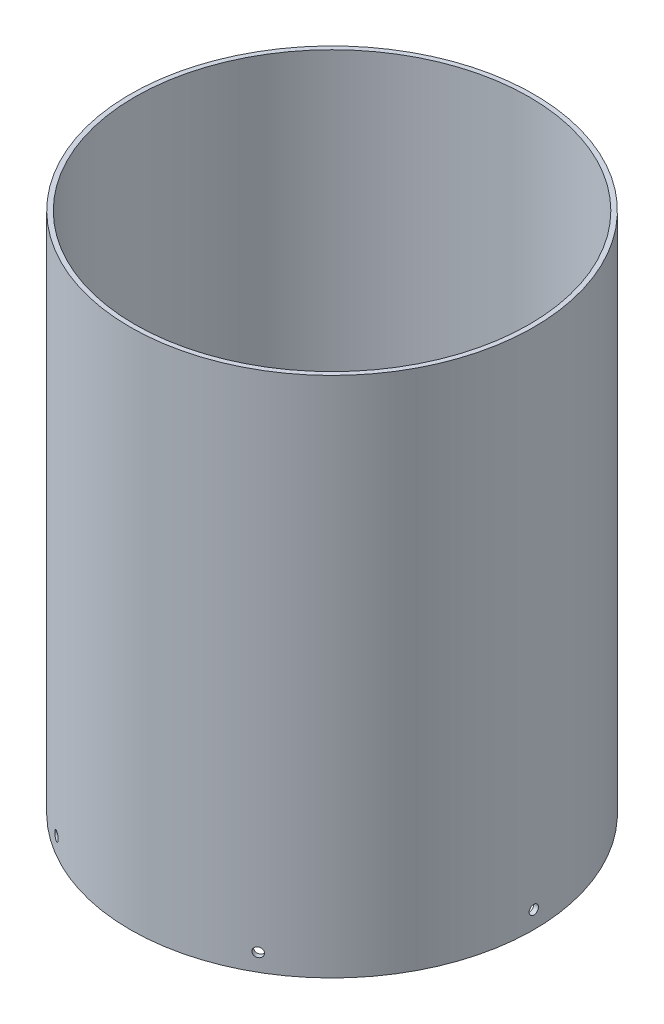
from build123d import *

# Parameters (mm, degrees)
SKETCH1_R               = 87
SKETCH1_R_2             = 85
BOSS_EXTRUDE1_DEPTH     = 225
CUT_EXTRUDE1_REACH      = 299.439
CUT_EXTRUDE1_END_RADIUS = 85
SKETCH2_R               = 2
CIRPATTERN1_COUNT       = 6


with BuildPart() as part:
    # Sketch1 → Boss-Extrude1 (new body)
    with BuildSketch(Plane(origin=(0, 0, 0), x_dir=(1, 0, 0), z_dir=(0, 1, 0))):
        with Locations(Location((0, 0, 0), (0, 0, 270))):
            Circle(SKETCH1_R)
        with Locations(Location((0, 0, 0), (0, 0, 270))):
            Circle(SKETCH1_R_2, mode=Mode.SUBTRACT)
    extrude(amount=BOSS_EXTRUDE1_DEPTH)

    # Cut-Extrude1: up to this cylinder (the profile starts outside it)
    cut_extrude1_end = Plane(origin=(0, 7.5, 0), z_dir=(0, -1, 0)) * Cylinder(CUT_EXTRUDE1_END_RADIUS, 769.878, mode=Mode.PRIVATE)
    # Sketch2 → Cut-Extrude1 (cut, up to the surface)
    with BuildSketch(Plane.ZY.offset(87), mode=Mode.PRIVATE) as cut_extrude1_sk1:
        with Locations((0, 7.5)):
            Circle(SKETCH2_R)
    cut_extrude1_tool1 = extrude(cut_extrude1_sk1.sketch, amount=-CUT_EXTRUDE1_REACH, mode=Mode.PRIVATE) - cut_extrude1_end
    cut_extrude1 = cut_extrude1_tool1.solids().sort_by_distance((-87, 7.5, 0))[0]
    add(cut_extrude1, mode=Mode.SUBTRACT)

    # CirPattern1: Cut-Extrude1 ×6 about axis
    cirpattern1_axis = Axis((0, 0, 0), (0, 1, 0))
    for i in range(1, CIRPATTERN1_COUNT):
        add(cut_extrude1.rotate(cirpattern1_axis, i * 360 / CIRPATTERN1_COUNT), mode=Mode.SUBTRACT)


solid = part.part
